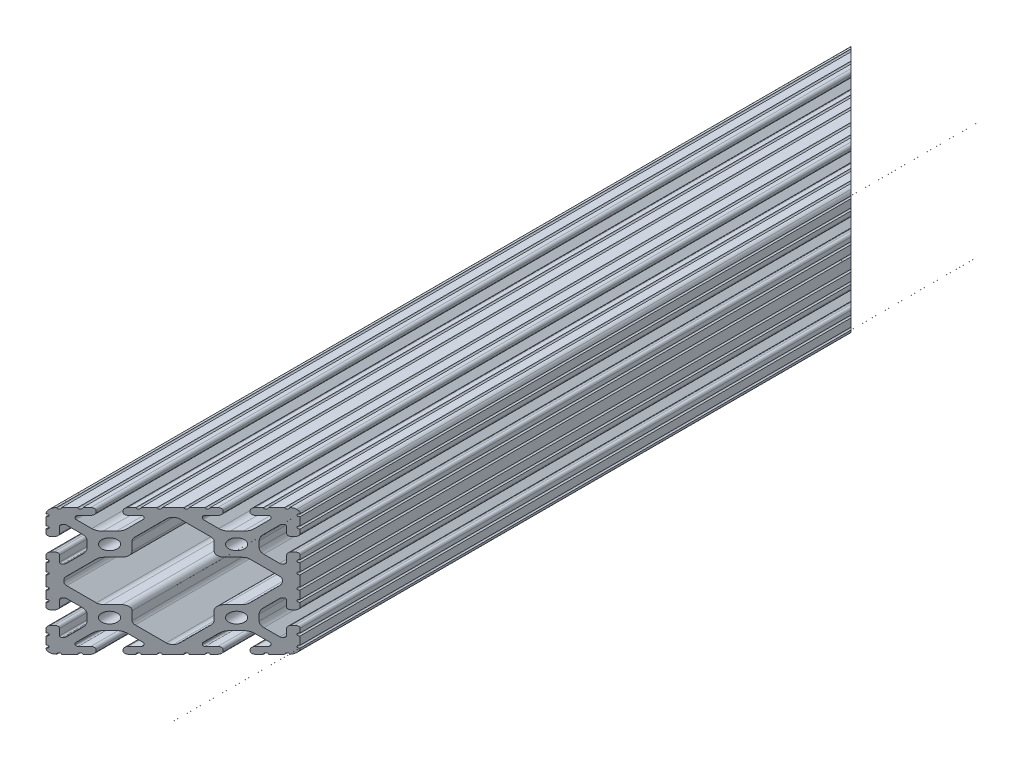
from build123d import *

# Parameters (mm, degrees)
SKETCH1_R           = 3.3274
BOSS_EXTRUDE1_DEPTH = 482.6
CUT_EXTRUDE1_DEPTH  = 616.524338674
CUT_EXTRUDE2_DEPTH  = 616.524338674


with BuildPart() as part:
    # Sketch1 → Boss-Extrude1 (new body)
    with BuildSketch(Plane(origin=(0, 0, -609.6), x_dir=(-1, 0, 0), z_dir=(0, 0, -1))):
        with BuildLine():
            Line((36.525200182, -23.055396049), (35.610799999, -23.055396049))
            ThreePointArc((35.610799999, -23.055396049), (34.49724824, -23.51664429), (34.035999999, -24.630196049))
            Line((34.035999999, -24.630196049), (34.035999999, -28.448000001))
            ThreePointArc((34.035999999, -28.448000001), (33.775617927, -29.07661793), (33.146999999, -29.337000001))
            Line((33.146999999, -29.337000001), (32.664287243, -29.337000001))
            ThreePointArc((32.664287243, -29.337000001), (32.324081166, -29.269328696), (32.035668541, -29.076617157))
            Line((32.035668541, -29.076617157), (27.197580079, -24.238516795))
            ThreePointArc((27.197580079, -24.238516795), (26.167955878, -22.697572205), (25.806399999, -20.879905136))
            Line((25.806399999, -20.879905136), (25.806399999, -17.220094864))
            ThreePointArc((25.806399999, -17.220094864), (26.167955878, -15.402427795), (27.197580079, -13.861483205))
            Line((27.197580079, -13.861483205), (31.948944539, -9.110107059))
            ThreePointArc((31.948944539, -9.110107059), (32.333417094, -8.853210197), (32.786933647, -8.763000001))
            Line((32.786933647, -8.763000001), (33.060275786, -8.763000001))
            ThreePointArc((33.060275786, -8.763000001), (33.750216993, -9.048783007), (34.035999999, -9.738724214))
            Line((34.035999999, -9.738724214), (34.035999999, -13.469803585))
            ThreePointArc((34.035999999, -13.469803585), (34.497248347, -14.583355602), (35.610800365, -15.044603951))
            Line((35.610800365, -15.044603951), (36.525199999, -15.044603951))
            ThreePointArc((36.525199999, -15.044603951), (37.638751758, -14.58335571), (38.099999999, -13.469803951))
            Line((38.099999999, -13.469803951), (38.099999999, -11.075039291))
            ThreePointArc((38.099999999, -11.075039291), (37.117000249, -10.313517274), (38.099999999, -9.551995256))
            Line((38.099999999, -9.551995256), (38.099999999, -4.723759309))
            ThreePointArc((38.099999999, -4.723759309), (37.117000249, -3.962237291), (38.099999999, -3.200715274))
            Line((38.099999999, -3.200715274), (38.099999999, 3.200715274))
            ThreePointArc((38.099999999, 3.200715274), (37.117000249, 3.962237291), (38.099999999, 4.723759309))
            Line((38.099999999, 4.723759309), (38.099999999, 9.551995254))
            ThreePointArc((38.099999999, 9.551995254), (37.117000249, 10.313517271), (38.099999999, 11.075039288))
            Line((38.099999999, 11.075039288), (38.099999999, 13.469803951))
            ThreePointArc((38.099999999, 13.469803951), (37.638751758, 14.58335571), (36.525199999, 15.044603951))
            Line((36.525199999, 15.044603951), (35.610800365, 15.044603951))
            ThreePointArc((35.610800365, 15.044603951), (34.497248347, 14.583355602), (34.035999999, 13.469803585))
            Line((34.035999999, 13.469803585), (34.035999999, 9.738724211))
            ThreePointArc((34.035999999, 9.738724211), (33.750216993, 9.048783004), (33.060275786, 8.762999999))
            Line((33.060275786, 8.762999999), (32.78693365, 8.762999999))
            ThreePointArc((32.78693365, 8.762999999), (32.333417097, 8.853210195), (31.948944542, 9.110107056))
            Line((31.948944542, 9.110107056), (27.197580079, 13.861483205))
            ThreePointArc((27.197580079, 13.861483205), (26.167955878, 15.402427795), (25.806399999, 17.220094864))
            Line((25.806399999, 17.220094864), (25.806399999, 20.879905136))
            ThreePointArc((25.806399999, 20.879905136), (26.167955878, 22.697572205), (27.19758008, 24.238516796))
            Line((27.19758008, 24.238516796), (32.035668541, 29.076617154))
            ThreePointArc((32.035668541, 29.076617154), (32.324081166, 29.269328694), (32.664287243, 29.336999999))
            Line((32.664287243, 29.336999999), (33.146999999, 29.336999999))
            ThreePointArc((33.146999999, 29.336999999), (33.775617927, 29.076617927), (34.035999999, 28.447999999))
            Line((34.035999999, 28.447999999), (34.035999999, 24.630196049))
            ThreePointArc((34.035999999, 24.630196049), (34.49724824, 23.51664429), (35.610799999, 23.055396049))
            Line((35.610799999, 23.055396049), (36.525200182, 23.055396049))
            ThreePointArc((36.525200182, 23.055396049), (37.638751811, 23.516644237), (38.099999999, 24.630195866))
            Line((38.099999999, 24.630195866), (38.099999999, 27.023826138))
            ThreePointArc((38.099999999, 27.023826138), (37.117780707, 27.7845421), (38.099999999, 28.545258063))
            Line((38.099999999, 28.545258063), (38.099999999, 33.373016026))
            ThreePointArc((38.099999999, 33.373016026), (37.141472622, 34.109236775), (38.1, 34.845457522))
            ThreePointArc((38.1, 34.845457522), (37.837757798, 36.120195039), (37.086123087, 37.182631848))
            ThreePointArc((37.086123087, 37.182631848), (36.106286535, 37.843374412), (34.952681874, 38.099999999))
            ThreePointArc((34.952681874, 38.099999999), (34.190730434, 37.320215334), (33.428778993, 38.099999999))
            Line((33.428778993, 38.099999999), (28.601105934, 38.099999999))
            ThreePointArc((28.601105934, 38.099999999), (27.83915858, 37.320219419), (27.077211226, 38.099999999))
            Line((27.077211226, 38.099999999), (24.688799999, 38.099999999))
            ThreePointArc((24.688799999, 38.099999999), (23.57524824, 37.638751758), (23.113999999, 36.525199999))
            Line((23.113999999, 36.525199999), (23.113999999, 35.610799999))
            ThreePointArc((23.113999999, 35.610799999), (23.57524824, 34.49724824), (24.688799999, 34.035999999))
            Line((24.688799999, 34.035999999), (28.447999999, 34.035999999))
            ThreePointArc((28.447999999, 34.035999999), (29.076617927, 33.775617927), (29.336999999, 33.146999999))
            Line((29.336999999, 33.146999999), (29.336999999, 32.720693457))
            ThreePointArc((29.336999999, 32.720693457), (29.326675076, 32.273872753), (29.100231244, 31.888543625))
            Line((29.100231244, 31.888543625), (24.409287498, 27.19758834))
            ThreePointArc((24.409287498, 27.19758834), (22.868340044, 26.167958113), (21.050667578, 25.806399999))
            Line((21.050667578, 25.806399999), (17.049332422, 25.806399999))
            ThreePointArc((17.049332422, 25.806399999), (15.231659956, 26.167958113), (13.690712502, 27.19758834))
            Line((13.690712502, 27.19758834), (9.023381297, 31.864931026))
            ThreePointArc((9.023381297, 31.864931026), (8.830670885, 32.153343115), (8.762999999, 32.493548181))
            Line((8.762999999, 32.493548181), (8.762999999, 33.146999999))
            ThreePointArc((8.762999999, 33.146999999), (9.02338207, 33.775617927), (9.651999999, 34.035999999))
            Line((9.651999999, 34.035999999), (13.411199999, 34.035999999))
            ThreePointArc((13.411199999, 34.035999999), (14.524751758, 34.49724824), (14.985999999, 35.610799999))
            Line((14.985999999, 35.610799999), (14.985999999, 36.525199999))
            ThreePointArc((14.985999999, 36.525199999), (14.524751758, 37.638751758), (13.411199999, 38.099999999))
            Line((13.411199999, 38.099999999), (11.128867073, 38.099999999))
            ThreePointArc((11.128867073, 38.099999999), (10.367071032, 37.320370692), (9.605274992, 38.099999999))
            Line((9.605274992, 38.099999999), (4.777313068, 38.099999999))
            ThreePointArc((4.777313068, 38.099999999), (4.015517027, 37.320370692), (3.253720987, 38.099999999))
            Line((3.253720987, 38.099999999), (-3.253720989, 38.099999999))
            ThreePointArc((-3.253720989, 38.099999999), (-4.01551703, 37.320370692), (-4.777313071, 38.099999999))
            Line((-4.777313071, 38.099999999), (-9.605274992, 38.099999999))
            ThreePointArc((-9.605274992, 38.099999999), (-10.367071032, 37.320370692), (-11.128867073, 38.099999999))
            Line((-11.128867073, 38.099999999), (-13.411200001, 38.099999999))
            ThreePointArc((-13.411200001, 38.099999999), (-14.52475176, 37.638751758), (-14.986000001, 36.525199999))
            Line((-14.986000001, 36.525199999), (-14.986000001, 35.610799999))
            ThreePointArc((-14.986000001, 35.610799999), (-14.52475176, 34.49724824), (-13.411200001, 34.035999999))
            Line((-13.411200001, 34.035999999), (-9.652000001, 34.035999999))
            ThreePointArc((-9.652000001, 34.035999999), (-9.023382073, 33.775617927), (-8.763000001, 33.146999999))
            Line((-8.763000001, 33.146999999), (-8.763000001, 32.493548178))
            ThreePointArc((-8.763000001, 32.493548178), (-8.830670888, 32.153343112), (-9.0233813, 31.864931023))
            Line((-9.0233813, 31.864931023), (-13.690712502, 27.19758834))
            ThreePointArc((-13.690712502, 27.19758834), (-15.231659956, 26.167958113), (-17.049332422, 25.806399999))
            Line((-17.049332422, 25.806399999), (-21.050667578, 25.806399999))
            ThreePointArc((-21.050667578, 25.806399999), (-22.868340044, 26.167958113), (-24.409287498, 27.19758834))
            Line((-24.409287498, 27.19758834), (-29.100231244, 31.888543625))
            ThreePointArc((-29.100231244, 31.888543625), (-29.326675074, 32.273872748), (-29.337000001, 32.720693446))
            Line((-29.337000001, 32.720693446), (-29.337000001, 33.146999999))
            ThreePointArc((-29.337000001, 33.146999999), (-29.07661793, 33.775617927), (-28.448000001, 34.035999999))
            Line((-28.448000001, 34.035999999), (-24.688800001, 34.035999999))
            ThreePointArc((-24.688800001, 34.035999999), (-23.575248242, 34.49724824), (-23.114000001, 35.610799999))
            Line((-23.114000001, 35.610799999), (-23.114000001, 36.525199999))
            ThreePointArc((-23.114000001, 36.525199999), (-23.575248242, 37.638751758), (-24.688800001, 38.099999999))
            Line((-24.688800001, 38.099999999), (-27.077211226, 38.099999999))
            ThreePointArc((-27.077211226, 38.099999999), (-27.83915858, 37.320219419), (-28.601105934, 38.099999999))
            Line((-28.601105934, 38.099999999), (-33.428778993, 38.099999999))
            ThreePointArc((-33.428778993, 38.099999999), (-34.190730434, 37.320215334), (-34.952681874, 38.099999999))
            ThreePointArc((-34.952681874, 38.099999999), (-36.106286561, 37.843374402), (-37.086123128, 37.18263181))
            ThreePointArc((-37.086123128, 37.18263181), (-37.837757809, 36.120195013), (-38.1, 34.845457522))
            ThreePointArc((-38.1, 34.845457522), (-37.141472622, 34.109236773), (-38.100000001, 33.373016026))
            Line((-38.100000001, 33.373016026), (-38.100000001, 28.545258062))
            ThreePointArc((-38.100000001, 28.545258062), (-37.117780707, 27.7845421), (-38.100000001, 27.023826138))
            Line((-38.100000001, 27.023826138), (-38.100000001, 24.630195866))
            ThreePointArc((-38.100000001, 24.630195866), (-37.638751814, 23.516644237), (-36.525200184, 23.055396049))
            Line((-36.525200184, 23.055396049), (-35.610800001, 23.055396049))
            ThreePointArc((-35.610800001, 23.055396049), (-34.497248242, 23.51664429), (-34.036000001, 24.630196049))
            Line((-34.036000001, 24.630196049), (-34.036000001, 28.447999999))
            ThreePointArc((-34.036000001, 28.447999999), (-33.77561793, 29.076617927), (-33.147000001, 29.336999999))
            Line((-33.147000001, 29.336999999), (-32.664287243, 29.336999999))
            ThreePointArc((-32.664287243, 29.336999999), (-32.324081166, 29.269328694), (-32.035668541, 29.076617154))
            Line((-32.035668541, 29.076617154), (-27.197580082, 24.238516798))
            ThreePointArc((-27.197580082, 24.238516798), (-26.16795588, 22.697572208), (-25.806400001, 20.879905138))
            Line((-25.806400001, 20.879905138), (-25.806400001, 17.220094862))
            ThreePointArc((-25.806400001, 17.220094862), (-26.16795588, 15.402427793), (-27.197580082, 13.861483203))
            Line((-27.197580082, 13.861483203), (-31.948944542, 9.110107056))
            ThreePointArc((-31.948944542, 9.110107056), (-32.333417097, 8.853210195), (-32.78693365, 8.762999999))
            Line((-32.78693365, 8.762999999), (-33.060275789, 8.762999999))
            ThreePointArc((-33.060275789, 8.762999999), (-33.750216996, 9.048783004), (-34.036000001, 9.738724211))
            Line((-34.036000001, 9.738724211), (-34.036000001, 13.469803585))
            ThreePointArc((-34.036000001, 13.469803585), (-34.497248349, 14.583355602), (-35.610800367, 15.044603951))
            Line((-35.610800367, 15.044603951), (-36.525200001, 15.044603951))
            ThreePointArc((-36.525200001, 15.044603951), (-37.63875176, 14.58335571), (-38.100000001, 13.469803951))
            Line((-38.100000001, 13.469803951), (-38.100000001, 11.075039288))
            ThreePointArc((-38.100000001, 11.075039288), (-37.117000249, 10.313517271), (-38.100000001, 9.551995254))
            Line((-38.100000001, 9.551995254), (-38.100000001, 4.723759308))
            ThreePointArc((-38.100000001, 4.723759308), (-37.117000249, 3.962237291), (-38.100000001, 3.200715275))
            Line((-38.100000001, 3.200715275), (-38.100000001, -3.200715275))
            ThreePointArc((-38.100000001, -3.200715275), (-37.117000249, -3.962237291), (-38.100000001, -4.723759308))
            Line((-38.100000001, -4.723759308), (-38.100000001, -9.551995257))
            ThreePointArc((-38.100000001, -9.551995257), (-37.117000249, -10.313517274), (-38.100000001, -11.07503929))
            Line((-38.100000001, -11.07503929), (-38.100000001, -13.469803951))
            ThreePointArc((-38.100000001, -13.469803951), (-37.63875176, -14.58335571), (-36.525200001, -15.044603951))
            Line((-36.525200001, -15.044603951), (-35.610800367, -15.044603951))
            ThreePointArc((-35.610800367, -15.044603951), (-34.497248349, -14.583355602), (-34.036000001, -13.469803585))
            Line((-34.036000001, -13.469803585), (-34.036000001, -9.738724214))
            ThreePointArc((-34.036000001, -9.738724214), (-33.750216996, -9.048783007), (-33.060275789, -8.763000001))
            Line((-33.060275789, -8.763000001), (-32.786933647, -8.763000001))
            ThreePointArc((-32.786933647, -8.763000001), (-32.333417094, -8.853210197), (-31.948944539, -9.110107059))
            Line((-31.948944539, -9.110107059), (-27.197580082, -13.861483203))
            ThreePointArc((-27.197580082, -13.861483203), (-26.16795588, -15.402427793), (-25.806400001, -17.220094862))
            Line((-25.806400001, -17.220094862), (-25.806400001, -20.879905138))
            ThreePointArc((-25.806400001, -20.879905138), (-26.16795588, -22.697572207), (-27.197580082, -24.238516797))
            Line((-27.197580082, -24.238516797), (-32.035668541, -29.076617157))
            ThreePointArc((-32.035668541, -29.076617157), (-32.324081166, -29.269328696), (-32.664287243, -29.337000001))
            Line((-32.664287243, -29.337000001), (-33.147000001, -29.337000001))
            ThreePointArc((-33.147000001, -29.337000001), (-33.77561793, -29.07661793), (-34.036000001, -28.448000001))
            Line((-34.036000001, -28.448000001), (-34.036000001, -24.630196049))
            ThreePointArc((-34.036000001, -24.630196049), (-34.497248242, -23.51664429), (-35.610800001, -23.055396049))
            Line((-35.610800001, -23.055396049), (-36.525200184, -23.055396049))
            ThreePointArc((-36.525200184, -23.055396049), (-37.638751814, -23.516644237), (-38.100000001, -24.630195866))
            Line((-38.100000001, -24.630195866), (-38.100000001, -27.023826138))
            ThreePointArc((-38.100000001, -27.023826138), (-37.117780707, -27.7845421), (-38.100000001, -28.545258062))
            Line((-38.100000001, -28.545258062), (-38.100000001, -33.373016026))
            ThreePointArc((-38.100000001, -33.373016026), (-37.141472622, -34.109236773), (-38.1, -34.845457522))
            ThreePointArc((-38.1, -34.845457522), (-37.83775782, -36.120194987), (-37.086123169, -37.182631771))
            ThreePointArc((-37.086123169, -37.182631771), (-36.106286588, -37.843374393), (-34.952681874, -38.100000001))
            ThreePointArc((-34.952681874, -38.100000001), (-34.190730434, -37.320215336), (-33.428778993, -38.100000001))
            Line((-33.428778993, -38.100000001), (-28.601105934, -38.100000001))
            ThreePointArc((-28.601105934, -38.100000001), (-27.83915858, -37.320219421), (-27.077211226, -38.100000001))
            Line((-27.077211226, -38.100000001), (-24.688800001, -38.100000001))
            ThreePointArc((-24.688800001, -38.100000001), (-23.575248242, -37.63875176), (-23.114000001, -36.525200001))
            Line((-23.114000001, -36.525200001), (-23.114000001, -35.610800001))
            ThreePointArc((-23.114000001, -35.610800001), (-23.575248242, -34.497248242), (-24.688800001, -34.036000001))
            Line((-24.688800001, -34.036000001), (-28.448000001, -34.036000001))
            ThreePointArc((-28.448000001, -34.036000001), (-29.07661793, -33.77561793), (-29.337000001, -33.147000001))
            Line((-29.337000001, -33.147000001), (-29.337000001, -32.720693446))
            ThreePointArc((-29.337000001, -32.720693446), (-29.326675074, -32.273872748), (-29.100231244, -31.888543625))
            Line((-29.100231244, -31.888543625), (-24.409287501, -27.197588343))
            ThreePointArc((-24.409287501, -27.197588343), (-22.868340046, -26.167958116), (-21.050667581, -25.806400001))
            Line((-21.050667581, -25.806400001), (-17.049332419, -25.806400001))
            ThreePointArc((-17.049332419, -25.806400001), (-15.231659954, -26.167958116), (-13.690712499, -27.197588343))
            Line((-13.690712499, -27.197588343), (-9.0233813, -31.864931023))
            ThreePointArc((-9.0233813, -31.864931023), (-8.830670888, -32.153343112), (-8.763000001, -32.493548178))
            Line((-8.763000001, -32.493548178), (-8.763000001, -33.147000001))
            ThreePointArc((-8.763000001, -33.147000001), (-9.023382073, -33.77561793), (-9.652000001, -34.036000001))
            Line((-9.652000001, -34.036000001), (-13.411200001, -34.036000001))
            ThreePointArc((-13.411200001, -34.036000001), (-14.52475176, -34.497248242), (-14.986000001, -35.610800001))
            Line((-14.986000001, -35.610800001), (-14.986000001, -36.525200001))
            ThreePointArc((-14.986000001, -36.525200001), (-14.52475176, -37.63875176), (-13.411200001, -38.100000001))
            Line((-13.411200001, -38.100000001), (-11.128867073, -38.100000001))
            ThreePointArc((-11.128867073, -38.100000001), (-10.367071032, -37.320370694), (-9.605274992, -38.100000001))
            Line((-9.605274992, -38.100000001), (-4.777313071, -38.100000001))
            ThreePointArc((-4.777313071, -38.100000001), (-4.01551703, -37.320370694), (-3.253720989, -38.100000001))
            Line((-3.253720989, -38.100000001), (3.253720987, -38.100000001))
            ThreePointArc((3.253720987, -38.100000001), (4.015517027, -37.320370694), (4.777313068, -38.100000001))
            Line((4.777313068, -38.100000001), (9.605274992, -38.100000001))
            ThreePointArc((9.605274992, -38.100000001), (10.367071032, -37.320370694), (11.128867073, -38.100000001))
            Line((11.128867073, -38.100000001), (13.411199999, -38.100000001))
            ThreePointArc((13.411199999, -38.100000001), (14.524751758, -37.63875176), (14.985999999, -36.525200001))
            Line((14.985999999, -36.525200001), (14.985999999, -35.610800001))
            ThreePointArc((14.985999999, -35.610800001), (14.524751758, -34.497248242), (13.411199999, -34.036000001))
            Line((13.411199999, -34.036000001), (9.651999999, -34.036000001))
            ThreePointArc((9.651999999, -34.036000001), (9.02338207, -33.77561793), (8.762999999, -33.147000001))
            Line((8.762999999, -33.147000001), (8.762999999, -32.493548181))
            ThreePointArc((8.762999999, -32.493548181), (8.830670885, -32.153343115), (9.023381297, -31.864931026))
            Line((9.023381297, -31.864931026), (13.690712499, -27.197588343))
            ThreePointArc((13.690712499, -27.197588343), (15.231659954, -26.167958116), (17.049332419, -25.806400001))
            Line((17.049332419, -25.806400001), (21.050667581, -25.806400001))
            ThreePointArc((21.050667581, -25.806400001), (22.868340046, -26.167958116), (24.409287501, -27.197588343))
            Line((24.409287501, -27.197588343), (29.100231244, -31.888543625))
            ThreePointArc((29.100231244, -31.888543625), (29.326675076, -32.273872753), (29.336999999, -32.720693457))
            Line((29.336999999, -32.720693457), (29.336999999, -33.147000001))
            ThreePointArc((29.336999999, -33.147000001), (29.076617927, -33.77561793), (28.447999999, -34.036000001))
            Line((28.447999999, -34.036000001), (24.688799999, -34.036000001))
            ThreePointArc((24.688799999, -34.036000001), (23.57524824, -34.497248242), (23.113999999, -35.610800001))
            Line((23.113999999, -35.610800001), (23.113999999, -36.525200001))
            ThreePointArc((23.113999999, -36.525200001), (23.57524824, -37.63875176), (24.688799999, -38.100000001))
            Line((24.688799999, -38.100000001), (27.077211226, -38.100000001))
            ThreePointArc((27.077211226, -38.100000001), (27.83915858, -37.320219421), (28.601105934, -38.100000001))
            Line((28.601105934, -38.100000001), (33.428778993, -38.100000001))
            ThreePointArc((33.428778993, -38.100000001), (34.190730434, -37.320215336), (34.952681874, -38.100000001))
            ThreePointArc((34.952681874, -38.100000001), (36.106286561, -37.843374403), (37.086123128, -37.182631809))
            ThreePointArc((37.086123128, -37.182631809), (37.837757809, -36.120195013), (38.1, -34.845457522))
            ThreePointArc((38.1, -34.845457522), (37.141472622, -34.109236775), (38.099999999, -33.373016026))
            Line((38.099999999, -33.373016026), (38.099999999, -28.545258063))
            ThreePointArc((38.099999999, -28.545258063), (37.117780707, -27.7845421), (38.099999999, -27.023826138))
            Line((38.099999999, -27.023826138), (38.099999999, -24.630195866))
            ThreePointArc((38.099999999, -24.630195866), (37.638751811, -23.516644237), (36.525200182, -23.055396049))
        make_face()
        with Locations((19.049999999, -19.050000001)):
            Circle(SKETCH1_R, mode=Mode.SUBTRACT)
        with Locations((19.049999999, 19.049999999)):
            Circle(SKETCH1_R, mode=Mode.SUBTRACT)
        with Locations((-19.050000001, 19.049999999)):
            Circle(SKETCH1_R, mode=Mode.SUBTRACT)
        with Locations((-19.050000001, -19.050000001)):
            Circle(SKETCH1_R, mode=Mode.SUBTRACT)
        with BuildLine():
            Line((31.902125566, -2.475607376), (23.014093535, -11.36366127))
            ThreePointArc((23.014093535, -11.36366127), (21.984048445, -12.05191677), (20.769026744, -12.293600001))
            Line((20.769026744, -12.293600001), (15.468599999, -12.293600001))
            ThreePointArc((15.468599999, -12.293600001), (13.223535968, -13.223535971), (12.293599999, -15.468600001))
            Line((12.293599999, -15.468600001), (12.293599999, -20.598259734))
            ThreePointArc((12.293599999, -20.598259734), (12.051918262, -21.813277828), (11.36366679, -22.843321004))
            Line((11.36366679, -22.843321004), (2.051515951, -32.155494748))
            ThreePointArc((2.051515951, -32.155494748), (1.11031328, -32.786013752), (0, -33.011005091))
            ThreePointArc((0, -33.011005091), (-1.11031328, -32.786013752), (-2.051515951, -32.155494748))
            Line((-2.051515951, -32.155494748), (-11.363666793, -22.843321001))
            ThreePointArc((-11.363666793, -22.843321001), (-12.051918264, -21.813277826), (-12.293600001, -20.598259732))
            Line((-12.293600001, -20.598259732), (-12.293600001, -15.468600001))
            ThreePointArc((-12.293600001, -15.468600001), (-13.223535971, -13.223535971), (-15.468600001, -12.293600001))
            Line((-15.468600001, -12.293600001), (-20.769026744, -12.293600001))
            ThreePointArc((-20.769026744, -12.293600001), (-21.984048445, -12.05191677), (-23.014093535, -11.36366127))
            Line((-23.014093535, -11.36366127), (-31.902125566, -2.475607376))
            ThreePointArc((-31.902125566, -2.475607376), (-32.607298578, -1.335259481), (-32.728725173, 0))
            ThreePointArc((-32.728725173, 0), (-32.607298578, 1.335259481), (-31.902125566, 2.475607376))
            Line((-31.902125566, 2.475607376), (-23.014093538, 11.363661268))
            ThreePointArc((-23.014093538, 11.363661268), (-21.984048448, 12.051916767), (-20.769026746, 12.293599999))
            Line((-20.769026746, 12.293599999), (-15.468600001, 12.293599999))
            ThreePointArc((-15.468600001, 12.293599999), (-13.223535971, 13.223535968), (-12.293600001, 15.468599999))
            Line((-12.293600001, 15.468599999), (-12.293600001, 20.598259732))
            ThreePointArc((-12.293600001, 20.598259732), (-12.051918264, 21.813277826), (-11.363666793, 22.843321001))
            Line((-11.363666793, 22.843321001), (-2.051515951, 32.155494748))
            ThreePointArc((-2.051515951, 32.155494748), (-1.11031328, 32.786013752), (0, 33.011005091))
            ThreePointArc((0, 33.011005091), (1.11031328, 32.786013752), (2.051515951, 32.155494748))
            Line((2.051515951, 32.155494748), (11.36366679, 22.843321004))
            ThreePointArc((11.36366679, 22.843321004), (12.051918262, 21.813277828), (12.293599999, 20.598259734))
            Line((12.293599999, 20.598259734), (12.293599999, 15.468599999))
            ThreePointArc((12.293599999, 15.468599999), (13.223535968, 13.223535968), (15.468599999, 12.293599999))
            Line((15.468599999, 12.293599999), (20.769026746, 12.293599999))
            ThreePointArc((20.769026746, 12.293599999), (21.984048448, 12.051916767), (23.014093538, 11.363661268))
            Line((23.014093538, 11.363661268), (31.902125566, 2.475607376))
            ThreePointArc((31.902125566, 2.475607376), (32.607298578, 1.335259481), (32.728725173, 0))
            ThreePointArc((32.728725173, 0), (32.607298578, -1.335259481), (31.902125566, -2.475607376))
        make_face(mode=Mode.SUBTRACT)
    extrude(amount=-BOSS_EXTRUDE1_DEPTH)

    # Sketch3 → Cut-Extrude1 (cut, through all)
    with BuildSketch(Plane(origin=(0, 38.099999999, 0), x_dir=(1, 0, 0), z_dir=(0, 1, 0))):
        Polygon((-38.1, 609.6), (38.1, 609.6), (38.1, 533.4), align=None)
    extrude(amount=-CUT_EXTRUDE1_DEPTH, mode=Mode.SUBTRACT)

    # Sketch6 → Cut-Extrude2 (cut, through all)
    with BuildSketch(Plane(origin=(0, 38.099999999, 0), x_dir=(1, 0, 0), z_dir=(0, 1, 0))):
        Polygon((-38.099999999, 127), (38.100000001, 127), (38.100000001, 203.2), align=None)
    extrude(amount=-CUT_EXTRUDE2_DEPTH, mode=Mode.SUBTRACT)


solid = part.part
